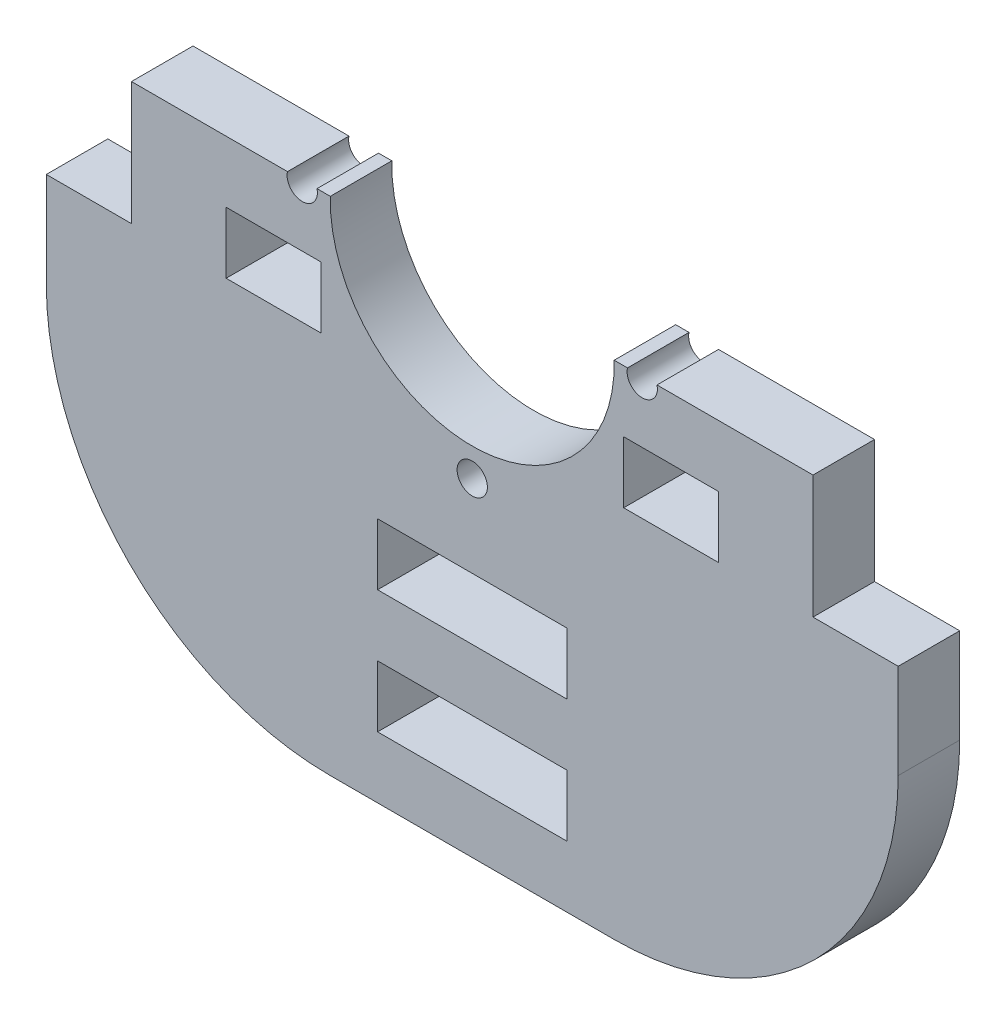
from build123d import *

# Parameters (mm, degrees)
SKETCH1_W                  = 72
SKETCH1_H                  = 13
SKETCH1_W_2                = 90
SKETCH1_H_2                = 40
BOSS_EXTRUDE1_DEPTH        = 6.5
FILLET2_R                  = 30
SKETCH2_R                  = 15
SKETCH2_R_2                = 1.6
MOTOR_CLEARANCE_DEPTH      = 105.648220243
CUT_SIDE_WHEEL_HOLES_REACH = 106.648
SKETCH3_W                  = 10
SKETCH3_H                  = 6.5
CUT_EXTRUDE1_REACH         = 106.648
SKETCH5_W                  = 20
SKETCH5_H                  = 6.5


with BuildPart() as part:
    # Sketch1 → Boss-Extrude1 (new body)
    with BuildSketch(Plane.XY):
        with Locations((45, 46.5)):
            Rectangle(SKETCH1_W, SKETCH1_H)
        with Locations((45, 20)):
            Rectangle(SKETCH1_W_2, SKETCH1_H_2)
    extrude(amount=BOSS_EXTRUDE1_DEPTH)

    # Fillet2
    fillet2_edges = [part.edges().sort_by_distance(p)[0] for p in [
        (90, 0, 3.25),
        (0, 0, 3.25),
    ]]
    fillet(fillet2_edges, radius=FILLET2_R)

    # Sketch2 → motor clearance (cut, through all)
    with BuildSketch(Plane.XY.offset(6.5)):
        with Locations((45, 52.639320225)):
            Circle(SKETCH2_R)
        with Locations((62.960512242, 52.639320225)):
            Circle(SKETCH2_R_2)
        with Locations((45, 34.678807983)):
            Circle(SKETCH2_R_2)
        with Locations((27.039487758, 52.639320225)):
            Circle(SKETCH2_R_2)
    extrude(amount=-MOTOR_CLEARANCE_DEPTH, mode=Mode.SUBTRACT)

    # Sketch3 → cut side wheel holes (cut, up to next)
    with BuildSketch(Plane.XY.offset(6.5), mode=Mode.PRIVATE) as cut_side_wheel_holes_sk1:
        with Locations((24, 43.25)):
            Rectangle(SKETCH3_W, SKETCH3_H)
    cut_side_wheel_holes_tool1 = extrude(cut_side_wheel_holes_sk1.sketch, amount=-CUT_SIDE_WHEEL_HOLES_REACH, mode=Mode.PRIVATE) & part.part
    # Sketch3 → cut side wheel holes (cut, up to next)
    with BuildSketch(Plane.XY.offset(6.5), mode=Mode.PRIVATE) as cut_side_wheel_holes_sk2:
        with Locations((66, 43.25)):
            Rectangle(SKETCH3_W, SKETCH3_H)
    cut_side_wheel_holes_tool2 = extrude(cut_side_wheel_holes_sk2.sketch, amount=-CUT_SIDE_WHEEL_HOLES_REACH, mode=Mode.PRIVATE) & part.part
    add(cut_side_wheel_holes_tool1.solids().sort_by_distance((24, 43.25, 6.5))[0], mode=Mode.SUBTRACT)
    add(cut_side_wheel_holes_tool2.solids().sort_by_distance((66, 43.25, 6.5))[0], mode=Mode.SUBTRACT)

    # Sketch5 → Cut-Extrude1 (cut, up to next)
    with BuildSketch(Plane.XY.offset(6.5), mode=Mode.PRIVATE) as cut_extrude1_sk1:
        with Locations((45, 22.75)):
            Rectangle(SKETCH5_W, SKETCH5_H)
    cut_extrude1_tool1 = extrude(cut_extrude1_sk1.sketch, amount=-CUT_EXTRUDE1_REACH, mode=Mode.PRIVATE) & part.part
    # Sketch5 → Cut-Extrude1 (cut, up to next)
    with BuildSketch(Plane.XY.offset(6.5), mode=Mode.PRIVATE) as cut_extrude1_sk2:
        with Locations((45, 9.75)):
            Rectangle(SKETCH5_W, SKETCH5_H)
    cut_extrude1_tool2 = extrude(cut_extrude1_sk2.sketch, amount=-CUT_EXTRUDE1_REACH, mode=Mode.PRIVATE) & part.part
    add(cut_extrude1_tool1.solids().sort_by_distance((45, 22.75, 6.5))[0], mode=Mode.SUBTRACT)
    add(cut_extrude1_tool2.solids().sort_by_distance((45, 9.75, 6.5))[0], mode=Mode.SUBTRACT)


solid = part.part
